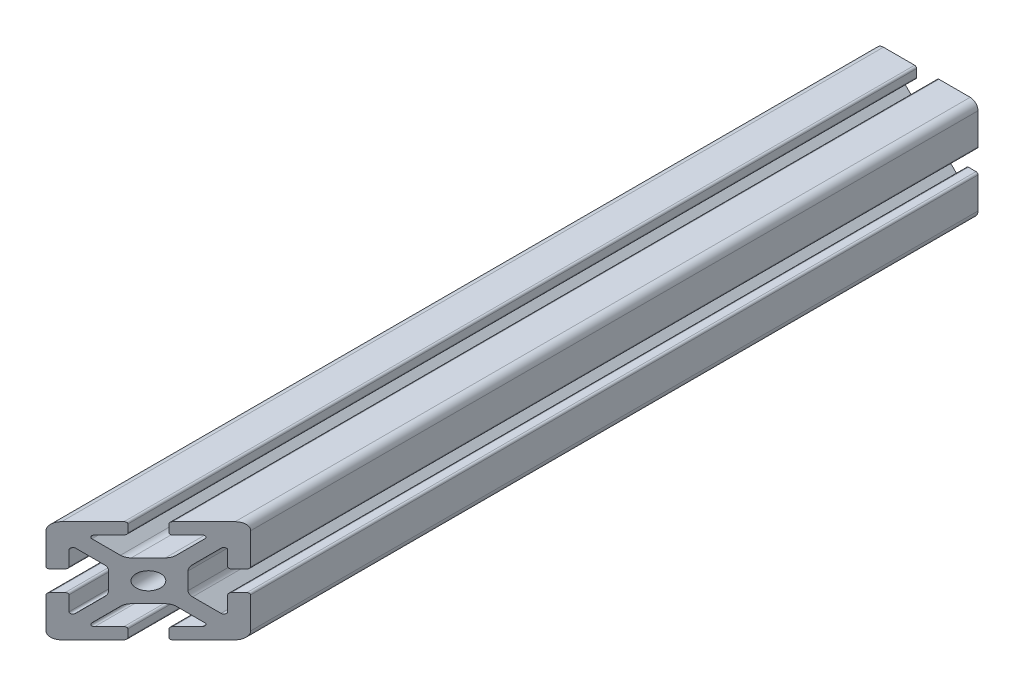
from build123d import *

# Parameters (mm, degrees)
SKETCH1_R          = 3.4036
EXTRUDE1_DEPTH     = 190.5
CUT_EXTRUDE1_REACH = 197.079
CUT_EXTRUDE2_DEPTH = 3.048


with BuildPart() as part:
    # Sketch1 → Extrude1 (new, symmetric)
    with BuildSketch(Plane.XY):
        with BuildLine():
            Line((-20, 16.952), (-20, 4.7625))
            ThreePointArc((-20, 4.7625), (-19.776815367, 4.223684633), (-19.238, 4.0005))
            Line((-19.238, 4.0005), (-16.2662, 4.0005))
            ThreePointArc((-16.2662, 4.0005), (-15.727384633, 4.223684633), (-15.5042, 4.7625))
            Line((-15.5042, 4.7625), (-15.5042, 10.485558599))
            ThreePointArc((-15.5042, 10.485558599), (-15.033804775, 11.189554802), (-14.203384633, 11.024373966))
            Line((-14.203384633, 11.024373966), (-8.635059555, 5.456048889))
            ThreePointArc((-8.635059555, 5.456048889), (-7.985348265, 4.483687227), (-7.7572, 3.336708444))
            Line((-7.7572, 3.336708444), (-7.7572, -3.336708444))
            ThreePointArc((-7.7572, -3.336708444), (-7.985348265, -4.483687227), (-8.635059555, -5.456048889))
            Line((-8.635059555, -5.456048889), (-14.203384633, -11.024373966))
            ThreePointArc((-14.203384633, -11.024373966), (-15.033804775, -11.189554802), (-15.5042, -10.485558599))
            Line((-15.5042, -10.485558599), (-15.5042, -4.7625))
            ThreePointArc((-15.5042, -4.7625), (-15.727384633, -4.223684633), (-16.2662, -4.0005))
            Line((-16.2662, -4.0005), (-19.238, -4.0005))
            ThreePointArc((-19.238, -4.0005), (-19.776815367, -4.223684633), (-20, -4.7625))
            Line((-20, -4.7625), (-20, -16.952))
            ThreePointArc((-20, -16.952), (-19.107261469, -19.107261469), (-16.952, -20))
            Line((-16.952, -20), (-4.7625, -20))
            ThreePointArc((-4.7625, -20), (-4.223684633, -19.776815367), (-4.0005, -19.238))
            Line((-4.0005, -19.238), (-4.0005, -16.2662))
            ThreePointArc((-4.0005, -16.2662), (-4.223684633, -15.727384633), (-4.7625, -15.5042))
            Line((-4.7625, -15.5042), (-10.485558599, -15.5042))
            ThreePointArc((-10.485558599, -15.5042), (-11.189554802, -15.033804775), (-11.024373966, -14.203384633))
            Line((-11.024373966, -14.203384633), (-5.456048889, -8.635059555))
            ThreePointArc((-5.456048889, -8.635059555), (-4.483687227, -7.985348265), (-3.336708444, -7.7572))
            Line((-3.336708444, -7.7572), (3.336708444, -7.7572))
            ThreePointArc((3.336708444, -7.7572), (4.483687227, -7.985348265), (5.456048889, -8.635059555))
            Line((5.456048889, -8.635059555), (11.024373966, -14.203384633))
            ThreePointArc((11.024373966, -14.203384633), (11.189554802, -15.033804775), (10.485558599, -15.5042))
            Line((10.485558599, -15.5042), (4.7625, -15.5042))
            ThreePointArc((4.7625, -15.5042), (4.223684633, -15.727384633), (4.0005, -16.2662))
            Line((4.0005, -16.2662), (4.0005, -19.238))
            ThreePointArc((4.0005, -19.238), (4.223684633, -19.776815367), (4.7625, -20))
            Line((4.7625, -20), (16.952, -20))
            ThreePointArc((16.952, -20), (19.107261469, -19.107261469), (20, -16.952))
            Line((20, -16.952), (20, -4.7625))
            ThreePointArc((20, -4.7625), (19.776815367, -4.223684633), (19.238, -4.0005))
            Line((19.238, -4.0005), (16.2662, -4.0005))
            ThreePointArc((16.2662, -4.0005), (15.727384633, -4.223684633), (15.5042, -4.7625))
            Line((15.5042, -4.7625), (15.5042, -10.485558599))
            ThreePointArc((15.5042, -10.485558599), (15.033804775, -11.189554802), (14.203384633, -11.024373966))
            Line((14.203384633, -11.024373966), (8.635059555, -5.456048889))
            ThreePointArc((8.635059555, -5.456048889), (7.985348265, -4.483687227), (7.7572, -3.336708444))
            Line((7.7572, -3.336708444), (7.7572, 3.336708444))
            ThreePointArc((7.7572, 3.336708444), (7.985348265, 4.483687227), (8.635059555, 5.456048889))
            Line((8.635059555, 5.456048889), (14.203384633, 11.024373966))
            ThreePointArc((14.203384633, 11.024373966), (15.033804775, 11.189554802), (15.5042, 10.485558599))
            Line((15.5042, 10.485558599), (15.5042, 4.7625))
            ThreePointArc((15.5042, 4.7625), (15.727384633, 4.223684633), (16.2662, 4.0005))
            Line((16.2662, 4.0005), (19.238, 4.0005))
            ThreePointArc((19.238, 4.0005), (19.776815367, 4.223684633), (20, 4.7625))
            Line((20, 4.7625), (20, 16.952))
            ThreePointArc((20, 16.952), (19.107261469, 19.107261469), (16.952, 20))
            Line((16.952, 20), (4.7625, 20))
            ThreePointArc((4.7625, 20), (4.223684633, 19.776815367), (4.0005, 19.238))
            Line((4.0005, 19.238), (4.0005, 16.2662))
            ThreePointArc((4.0005, 16.2662), (4.223684633, 15.727384633), (4.7625, 15.5042))
            Line((4.7625, 15.5042), (10.485558599, 15.5042))
            ThreePointArc((10.485558599, 15.5042), (11.189554802, 15.033804775), (11.024373966, 14.203384633))
            Line((11.024373966, 14.203384633), (5.456048889, 8.635059555))
            ThreePointArc((5.456048889, 8.635059555), (4.483687227, 7.985348265), (3.336708444, 7.7572))
            Line((3.336708444, 7.7572), (-3.336708444, 7.7572))
            ThreePointArc((-3.336708444, 7.7572), (-4.483687227, 7.985348265), (-5.456048889, 8.635059555))
            Line((-5.456048889, 8.635059555), (-11.024373966, 14.203384633))
            ThreePointArc((-11.024373966, 14.203384633), (-11.189554802, 15.033804775), (-10.485558599, 15.5042))
            Line((-10.485558599, 15.5042), (-4.7625, 15.5042))
            ThreePointArc((-4.7625, 15.5042), (-4.223684633, 15.727384633), (-4.0005, 16.2662))
            Line((-4.0005, 16.2662), (-4.0005, 19.238))
            ThreePointArc((-4.0005, 19.238), (-4.223684633, 19.776815367), (-4.7625, 20))
            Line((-4.7625, 20), (-16.952, 20))
            ThreePointArc((-16.952, 20), (-19.107261469, 19.107261469), (-20, 16.952))
        make_face()
        Circle(SKETCH1_R, mode=Mode.SUBTRACT)
    extrude(amount=EXTRUDE1_DEPTH, both=True)

    # Cut-Extrude1: up to this face of the body (flat: up to its plane)
    cut_extrude1_end = Plane(part.part.faces().sort_by_distance((-10.85725, 20, 0))[0])
    # Sketch6 → Cut-Extrude1 (cut, up to the picked face)
    with BuildSketch(Plane(origin=(0, -16.952, 0), x_dir=(-1, 0, 0), z_dir=(0, -1, 0)), mode=Mode.PRIVATE) as cut_extrude1_sk1:
        Polygon((-20, -93.69431704), (20, -133.69431704), (20, -190.5), (-20, -190.5), align=None)
    cut_extrude1_tool1 = split(extrude(cut_extrude1_sk1.sketch, amount=-CUT_EXTRUDE1_REACH, mode=Mode.PRIVATE), bisect_by=cut_extrude1_end, keep=Keep.BOTH, mode=Mode.PRIVATE)
    add(cut_extrude1_tool1.solids().sort_by(Axis((1.735983, -16.952, 151.229167), (0, 1, 0)))[0], mode=Mode.SUBTRACT)

    # Sketch7 → Cut-Extrude2 (cut)
    with BuildSketch(Plane(origin=(0, -16.952, 0), x_dir=(1, 0, 0), z_dir=(0, 1, 0))):
        Polygon((-20, -133.69431704), (20, -93.69431704), (20, -190.5), (-20, -190.5), align=None)
    extrude(amount=-CUT_EXTRUDE2_DEPTH, mode=Mode.SUBTRACT)


solid = part.part
